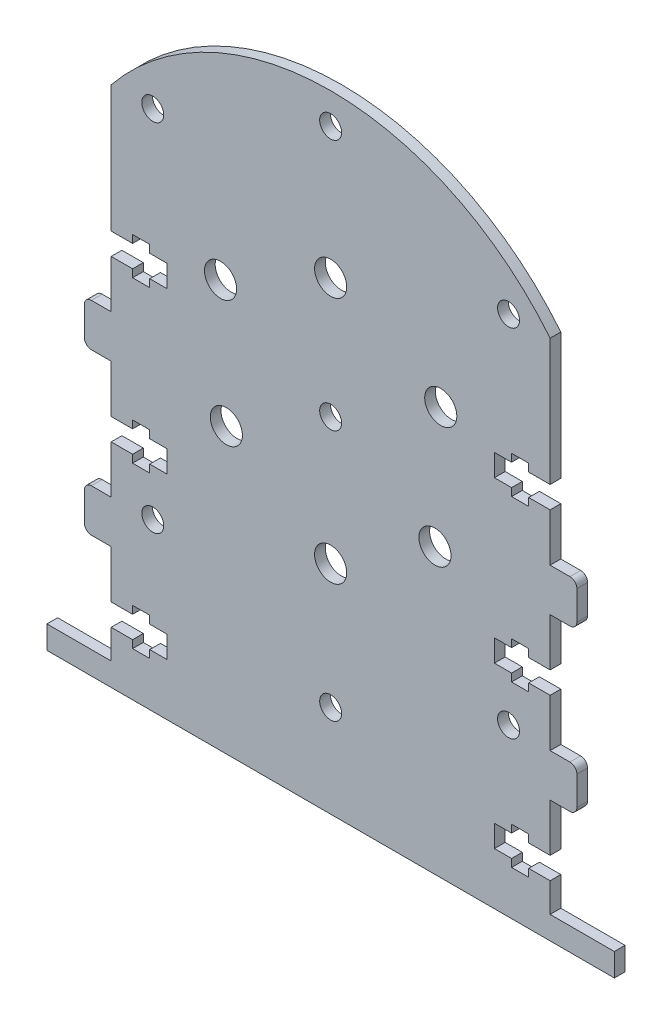
from build123d import *

# Parameters (mm, degrees)
SKETCH_1_R      = 3
SKETCH_1_R_2    = 2.05
EXTRUDE_2_DEPTH = 2
FILLET_1_R      = 1.3


with BuildPart() as part:
    # 草图1 → 凸台-拉伸2 (new body)
    with BuildSketch(Plane.XY):
        with BuildLine():
            Line((-55.962487977, 23.496493589), (-55.962487977, 8.046493589))
            Line((-55.962487977, 8.046493589), (-51.962487977, 8.046493589))
            Line((-51.962487977, 8.046493589), (-51.962487977, 9.496493589))
            Line((-51.962487977, 9.496493589), (-48.762487977, 9.496493589))
            Line((-48.762487977, 9.496493589), (-48.762487977, 8.046493589))
            Line((-48.762487977, 8.046493589), (-45.562487977, 8.046493589))
            Line((-45.562487977, 8.046493589), (-45.562487977, 3.946493589))
            Line((-45.562487977, 3.946493589), (-48.762487977, 3.946493589))
            Line((-48.762487977, 3.946493589), (-48.762487977, 2.496493589))
            Line((-48.762487977, 2.496493589), (-51.962487977, 2.496493589))
            Line((-51.962487977, 2.496493589), (-51.962487977, 3.946493589))
            Line((-51.962487977, 3.946493589), (-55.962487977, 3.946493589))
            Line((-55.962487977, 3.946493589), (-55.962487977, -5.003506411))
            Line((-55.962487977, -5.003506411), (-60.962487977, -5.003506411))
            Line((-60.962487977, -5.003506411), (-60.962487977, -13.003506411))
            Line((-60.962487977, -13.003506411), (-55.962487977, -13.003506411))
            Line((-55.962487977, -13.003506411), (-55.962487977, -21.953506411))
            Line((-55.962487977, -21.953506411), (-51.962487977, -21.953506411))
            Line((-51.962487977, -21.953506411), (-51.962487977, -20.503506411))
            Line((-51.962487977, -20.503506411), (-48.762487977, -20.503506411))
            Line((-48.762487977, -20.503506411), (-48.762487977, -21.953506411))
            Line((-48.762487977, -21.953506411), (-45.562487977, -21.953506411))
            Line((-45.562487977, -21.953506411), (-45.562487977, -26.053506411))
            Line((-45.562487977, -26.053506411), (-48.762487977, -26.053506411))
            Line((-48.762487977, -26.053506411), (-48.762487977, -27.503506411))
            Line((-48.762487977, -27.503506411), (-51.962487977, -27.503506411))
            Line((-51.962487977, -27.503506411), (-51.962487977, -26.053506411))
            Line((-51.962487977, -26.053506411), (-55.962487977, -26.053506411))
            Line((-55.962487977, -26.053506411), (-55.962487977, -35.003506411))
            Line((-55.962487977, -35.003506411), (-60.962487977, -35.003506411))
            Line((-60.962487977, -35.003506411), (-60.962487977, -43.003506411))
            Line((-60.962487977, -43.003506411), (-55.962487977, -43.003506411))
            Line((-55.962487977, -43.003506411), (-55.962487977, -51.953506411))
            Line((-55.962487977, -51.953506411), (-51.962487977, -51.953506411))
            Line((-51.962487977, -51.953506411), (-51.962487977, -50.503506411))
            Line((-51.962487977, -50.503506411), (-48.762487977, -50.503506411))
            Line((-48.762487977, -50.503506411), (-48.762487977, -51.953506411))
            Line((-48.762487977, -51.953506411), (-45.562487977, -51.953506411))
            Line((-45.562487977, -51.953506411), (-45.562487977, -56.053506411))
            Line((-45.562487977, -56.053506411), (-48.762487977, -56.053506411))
            Line((-48.762487977, -56.053506411), (-48.762487977, -57.503506411))
            Line((-48.762487977, -57.503506411), (-51.962487977, -57.503506411))
            Line((-51.962487977, -57.503506411), (-51.962487977, -56.053506411))
            Line((-51.962487977, -56.053506411), (-55.962487977, -56.053506411))
            Line((-55.962487977, -56.053506411), (-55.962487977, -61.503506411))
            Line((-55.962487977, -61.503506411), (-67.962487977, -61.503506411))
            Line((-67.962487977, -61.503506411), (-67.962487977, -65.791888255))
            Line((-67.962487977, -65.791888255), (38.037512023, -65.791888255))
            Line((38.037512023, -65.791888255), (38.037512023, -61.503506411))
            Line((38.037512023, -61.503506411), (26.037512023, -61.503506411))
            Line((26.037512023, -61.503506411), (26.037512023, -56.053506411))
            Line((26.037512023, -56.053506411), (22.037512023, -56.053506411))
            Line((22.037512023, -56.053506411), (22.037512023, -57.503506411))
            Line((22.037512023, -57.503506411), (18.837512023, -57.503506411))
            Line((18.837512023, -57.503506411), (18.837512023, -56.053506411))
            Line((18.837512023, -56.053506411), (15.637512023, -56.053506411))
            Line((15.637512023, -56.053506411), (15.637512023, -51.953506411))
            Line((15.637512023, -51.953506411), (18.837512023, -51.953506411))
            Line((18.837512023, -51.953506411), (18.837512023, -50.503506411))
            Line((18.837512023, -50.503506411), (22.037512023, -50.503506411))
            Line((22.037512023, -50.503506411), (22.037512023, -51.953506411))
            Line((22.037512023, -51.953506411), (26.037512023, -51.953506411))
            Line((26.037512023, -51.953506411), (26.037512023, -43.003506411))
            Line((26.037512023, -43.003506411), (31.037512023, -43.003506411))
            Line((31.037512023, -43.003506411), (31.037512023, -35.003506411))
            Line((31.037512023, -35.003506411), (26.037512023, -35.003506411))
            Line((26.037512023, -35.003506411), (26.037512023, -26.053506411))
            Line((26.037512023, -26.053506411), (22.037512023, -26.053506411))
            Line((22.037512023, -26.053506411), (22.037512023, -27.503506411))
            Line((22.037512023, -27.503506411), (18.837512023, -27.503506411))
            Line((18.837512023, -27.503506411), (18.837512023, -26.053506411))
            Line((18.837512023, -26.053506411), (15.637512023, -26.053506411))
            Line((15.637512023, -26.053506411), (15.637512023, -21.953506411))
            Line((15.637512023, -21.953506411), (18.837512023, -21.953506411))
            Line((18.837512023, -21.953506411), (18.837512023, -20.503506411))
            Line((18.837512023, -20.503506411), (22.037512023, -20.503506411))
            Line((22.037512023, -20.503506411), (22.037512023, -21.953506411))
            Line((22.037512023, -21.953506411), (26.037512023, -21.953506411))
            Line((26.037512023, -21.953506411), (26.037512023, -13.003506411))
            Line((26.037512023, -13.003506411), (31.037512023, -13.003506411))
            Line((31.037512023, -13.003506411), (31.037512023, -5.003506411))
            Line((31.037512023, -5.003506411), (26.037512023, -5.003506411))
            Line((26.037512023, -5.003506411), (26.037512023, 3.946493589))
            Line((26.037512023, 3.946493589), (22.037512023, 3.946493589))
            Line((22.037512023, 3.946493589), (22.037512023, 2.496493589))
            Line((22.037512023, 2.496493589), (18.837512023, 2.496493589))
            Line((18.837512023, 2.496493589), (18.837512023, 3.946493589))
            Line((18.837512023, 3.946493589), (15.637512023, 3.946493589))
            Line((15.637512023, 3.946493589), (15.637512023, 8.046493589))
            Line((15.637512023, 8.046493589), (18.837512023, 8.046493589))
            Line((18.837512023, 8.046493589), (18.837512023, 9.496493589))
            Line((18.837512023, 9.496493589), (22.037512023, 9.496493589))
            Line((22.037512023, 9.496493589), (22.037512023, 8.046493589))
            Line((22.037512023, 8.046493589), (26.037512023, 8.046493589))
            Line((26.037512023, 8.046493589), (26.037512023, 23.496493589))
            Line((26.037512023, 23.496493589), (26.037512023, 31.722989041))
            ThreePointArc((26.037512023, 31.722989041), (-14.962487977, 51.269592797), (-55.962487977, 31.722989041))
            Line((-55.962487977, 31.722989041), (-55.962487977, 23.496493589))
        make_face()
        with Locations((-14.962487977, -25.253506411)):
            Circle(SKETCH_1_R, mode=Mode.SUBTRACT)
        with Locations((4.523083608, -12.753506411)):
            Circle(SKETCH_1_R, mode=Mode.SUBTRACT)
        with Locations((-14.962487977, -1.503506411)):
            Circle(SKETCH_1_R_2, mode=Mode.SUBTRACT)
        with Locations((-35.530591317, 10.371493589)):
            Circle(SKETCH_1_R, mode=Mode.SUBTRACT)
        with Locations((-34.448059562, -12.753506411)):
            Circle(SKETCH_1_R, mode=Mode.SUBTRACT)
        with Locations((5.605615363, 10.371493589)):
            Circle(SKETCH_1_R, mode=Mode.SUBTRACT)
        with Locations((-14.962487977, 20.996493589)):
            Circle(SKETCH_1_R, mode=Mode.SUBTRACT)
        with Locations((18.271530739, -34.737525127)):
            Circle(SKETCH_1_R_2, mode=Mode.SUBTRACT)
        with Locations((-14.962487977, -48.503506411)):
            Circle(SKETCH_1_R_2, mode=Mode.SUBTRACT)
        with Locations((-48.196506692, -34.737525127)):
            Circle(SKETCH_1_R_2, mode=Mode.SUBTRACT)
        with Locations((-48.196506692, 31.730512305)):
            Circle(SKETCH_1_R_2, mode=Mode.SUBTRACT)
        with Locations((-14.962487977, 45.496493589)):
            Circle(SKETCH_1_R_2, mode=Mode.SUBTRACT)
        with Locations((18.271530739, 31.730512305)):
            Circle(SKETCH_1_R_2, mode=Mode.SUBTRACT)
    extrude(amount=EXTRUDE_2_DEPTH)

    # 圆角1
    fillet_1_edges = [part.edges().sort_by_distance(p)[0] for p in [
        (-60.962487977, -43.003506411, 1),
        (-60.962487977, -35.003506411, 1),
        (-60.962487977, -13.003506411, 1),
        (-60.962487977, -5.003506411, 1),
        (31.037512023, -5.003506411, 1),
        (31.037512023, -13.003506411, 1),
        (31.037512023, -35.003506411, 1),
        (31.037512023, -43.003506411, 1),
    ]]
    fillet(fillet_1_edges, radius=FILLET_1_R)


solid = part.part
